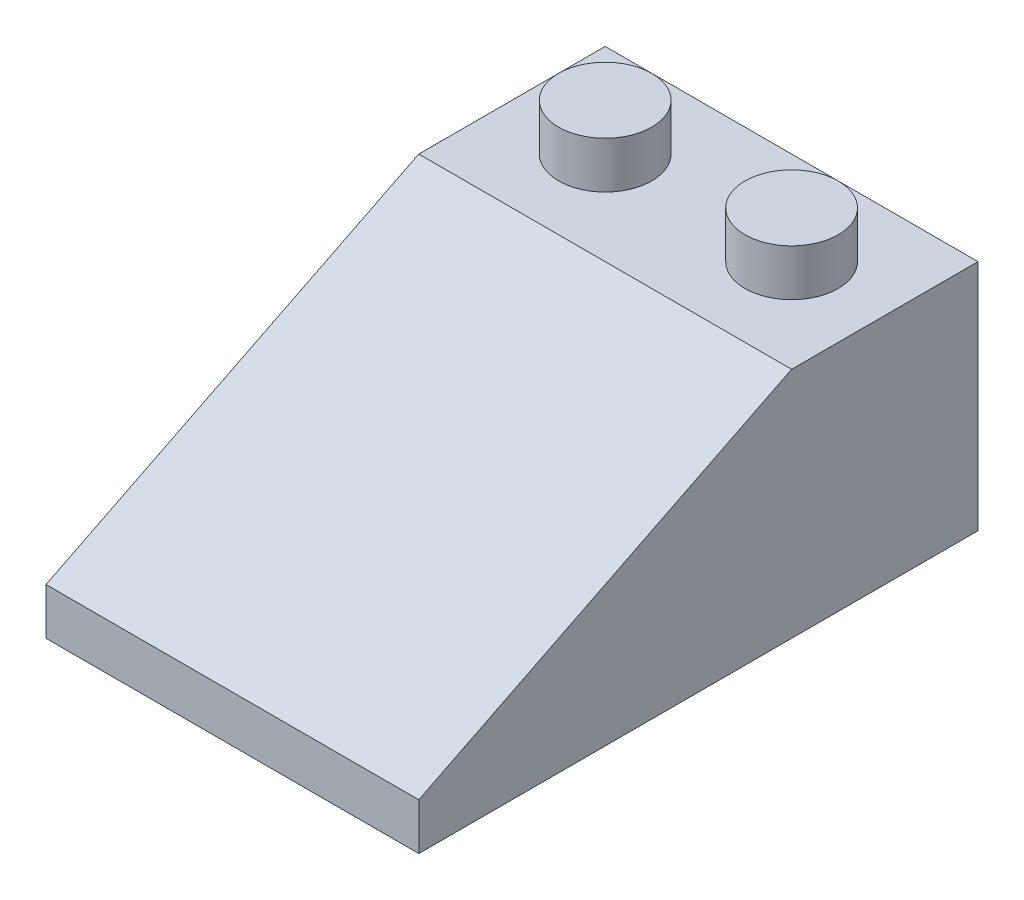
from build123d import *

# Parameters (mm, degrees)
BOSS_EXTRUDE1_DEPTH = 16
SKETCH2_R           = 2
BOSS_EXTRUDE2_DEPTH = 2
SHELL3_T            = -1
BOSS_EXTRUDE3_REACH = 33.241
SKETCH3_R           = 2.7
SKETCH3_R_2         = 1.7


with BuildPart() as part:
    # Sketch1 → Boss-Extrude1 (new body)
    with BuildSketch(Plane(origin=(0, 0, 0), x_dir=(0, 0, -1), z_dir=(1, 0, 0))):
        Polygon((-24, 0), (0, 0), (0, 10), (-8, 10), (-24, 2), align=None)
    extrude(amount=BOSS_EXTRUDE1_DEPTH)

    # Sketch2 → Boss-Extrude2 (add)
    with BuildSketch(Plane(origin=(0, 10, 0), x_dir=(1, 0, 0), z_dir=(0, 1, 0))):
        with Locations(Location((4, -4, 0), (0, 0, 90))):
            Circle(SKETCH2_R)
        with Locations(Location((12, -4, 0), (0, 0, 90))):
            Circle(SKETCH2_R)
    extrude(amount=BOSS_EXTRUDE2_DEPTH)

    # Shell3
    shell3_openings = [part.faces().sort_by_distance(p)[0] for p in [
        (8, 0, 12),
    ]]
    offset(amount=SHELL3_T, openings=shell3_openings, kind=Kind.INTERSECTION)

    # Sketch3 → Boss-Extrude3 (add, up to next)
    with BuildSketch(Plane.XZ, mode=Mode.PRIVATE) as boss_extrude3_sk1:
        with Locations(Location((8, 8, 0), (0, 0, 270))):
            Circle(SKETCH3_R)
        with Locations(Location((8, 8, 0), (0, 0, 270))):
            Circle(SKETCH3_R_2, mode=Mode.SUBTRACT)
    boss_extrude3_tool1 = extrude(boss_extrude3_sk1.sketch, amount=-BOSS_EXTRUDE3_REACH, mode=Mode.PRIVATE) - part.part
    # Sketch3 → Boss-Extrude3 (add, up to next)
    with BuildSketch(Plane.XZ, mode=Mode.PRIVATE) as boss_extrude3_sk2:
        with Locations(Location((8, 16, 0), (0, 0, 90))):
            Circle(SKETCH3_R)
        with Locations(Location((8, 16, 0), (0, 0, 90))):
            Circle(SKETCH3_R_2, mode=Mode.SUBTRACT)
    boss_extrude3_tool2 = extrude(boss_extrude3_sk2.sketch, amount=-BOSS_EXTRUDE3_REACH, mode=Mode.PRIVATE) - part.part
    add(boss_extrude3_tool1.solids().sort_by_distance((8, 0, 10.623632))[0])
    add(boss_extrude3_tool2.solids().sort_by_distance((8, 0, 13.376368))[0])


solid = part.part
